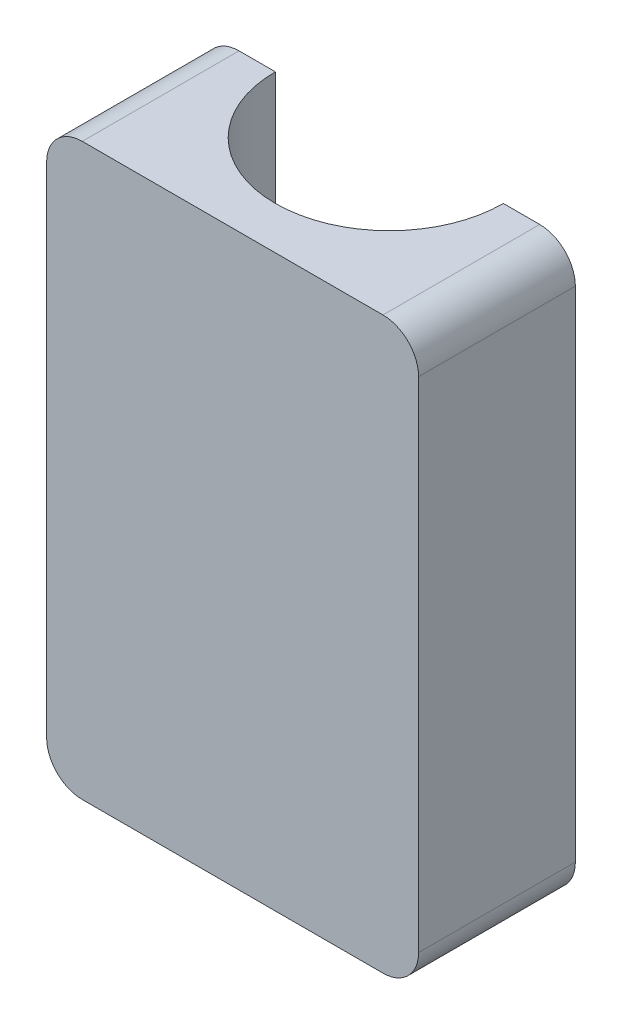
from build123d import *

# Parameters (mm, degrees)
ESQUISSE1_W             = 52.2
ESQUISSE1_H             = 80
BOSS_EXTRU_2_DEPTH      = 22
CONG_2_R                = 5
ESQUISSE2_R             = 16
ENL_V_MAT_EXTRU_3_DEPTH = 93.647092521


with BuildPart() as part:
    # Esquisse1 → Boss.-Extru.2 (new body)
    with BuildSketch(Plane.XY):
        with Locations((-15.124795362, -42.006460905)):
            Rectangle(ESQUISSE1_W, ESQUISSE1_H)
    extrude(amount=BOSS_EXTRU_2_DEPTH)

    # Congé2
    cong_2_edges = [part.edges().sort_by_distance(p)[0] for p in [
        (-41.224795362, -2.006460905, 11),
        (10.975204638, -2.006460905, 11),
        (10.975204638, -82.006460905, 11),
        (-41.224795362, -82.006460905, 11),
    ]]
    fillet(cong_2_edges, radius=CONG_2_R)

    # Esquisse2 → Enlèv. mat.-Extru.3 (cut, through all)
    with BuildSketch(Plane.XZ.offset(82.006460905)):
        with Locations((-15.124795362, 0)):
            Circle(ESQUISSE2_R)
    extrude(amount=-ENL_V_MAT_EXTRU_3_DEPTH, mode=Mode.SUBTRACT)


solid = part.part
